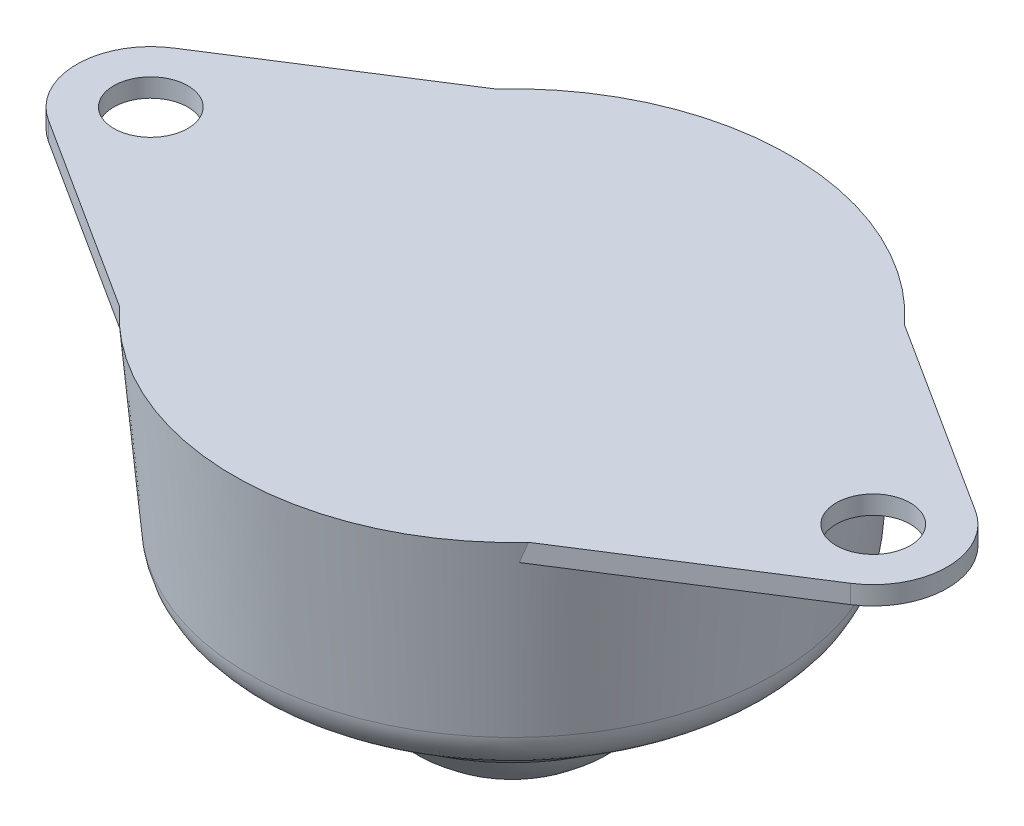
from build123d import *

# Parameters (mm, degrees)
FILLET1_R           = 2.5
SKETCH1_R           = 2
BOSS_EXTRUDE1_DEPTH = 1
FILLET2_R           = 0.25


with BuildPart() as part:
    # Sketch2 one side → Revolve1 (revolve)
    with BuildSketch(Plane.XY):
        with BuildLine():
            Line((0, -20), (0, -5))
            Line((0, -5), (0, 0))
            Line((0, 0), (-15, 0))
            Line((-15, 0), (-13.950136038, -12))
            Line((-13.950136038, -12), (-10.732050808, -12))
            Line((-10.732050808, -12), (-9, -15))
            Line((-9, -15), (-7.307879939, -15))
            Line((-7.307879939, -15), (-7.131103244, -14.823223305))
            ThreePointArc((-7.131103244, -14.823223305), (-4.406008694, -18.569356423), (0, -20))
        make_face()
    revolve(axis=Axis((0, 0, 0), (0, -1, 0)))

    # Fillet1
    fillet1_edges = [part.edges().sort_by_distance(p)[0] for p in [
        (9, -15, 0),
        (13.950136038, -12, 0),
    ]]
    fillet(fillet1_edges, radius=FILLET1_R)

    # Sketch1 → Boss-Extrude1 (add)
    # profile 1 of 2: a face of its own
    with BuildSketch(Plane(origin=(0, 0, 0), x_dir=(1, 0, 0), z_dir=(0, 1, 0))):
        with BuildLine():
            ThreePointArc((-21.653846154, 3.370600354), (-23.5, 0), (-21.653846154, -3.370600354))
            Line((-21.653846154, -3.370600354), (-7.807692308, -12.218426283))
            ThreePointArc((-7.807692308, -12.218426283), (-14.5, 0), (-7.807692308, 12.218426283))
            Line((-7.807692308, 12.218426283), (-21.653846154, 3.370600354))
        make_face()
        with Locations(Location((-19.5, 0, 0), (0, 0, 270))):
            Circle(SKETCH1_R, mode=Mode.SUBTRACT)
    # profile 2 of 2: a face of its own
    with BuildSketch(Plane(origin=(0, 0, 0), x_dir=(1, 0, 0), z_dir=(0, 1, 0))):
        with BuildLine():
            Line((21.653846154, 3.370600354), (7.807692308, 12.218426283))
            ThreePointArc((7.807692308, 12.218426283), (14.5, 0), (7.807692308, -12.218426283))
            Line((7.807692308, -12.218426283), (21.653846154, -3.370600354))
            ThreePointArc((21.653846154, -3.370600354), (23.5, 0), (21.653846154, 3.370600354))
        make_face()
        with Locations(Location((19.5, 0, 0), (0, 0, 270))):
            Circle(SKETCH1_R, mode=Mode.SUBTRACT)
    extrude(amount=-BOSS_EXTRUDE1_DEPTH)

    # Fillet2
    fillet2_edges = [part.edges().sort_by_distance(p)[0] for p in [
        (7.307879939, -15, 0),
    ]]
    fillet(fillet2_edges, radius=FILLET2_R)


solid = part.part
